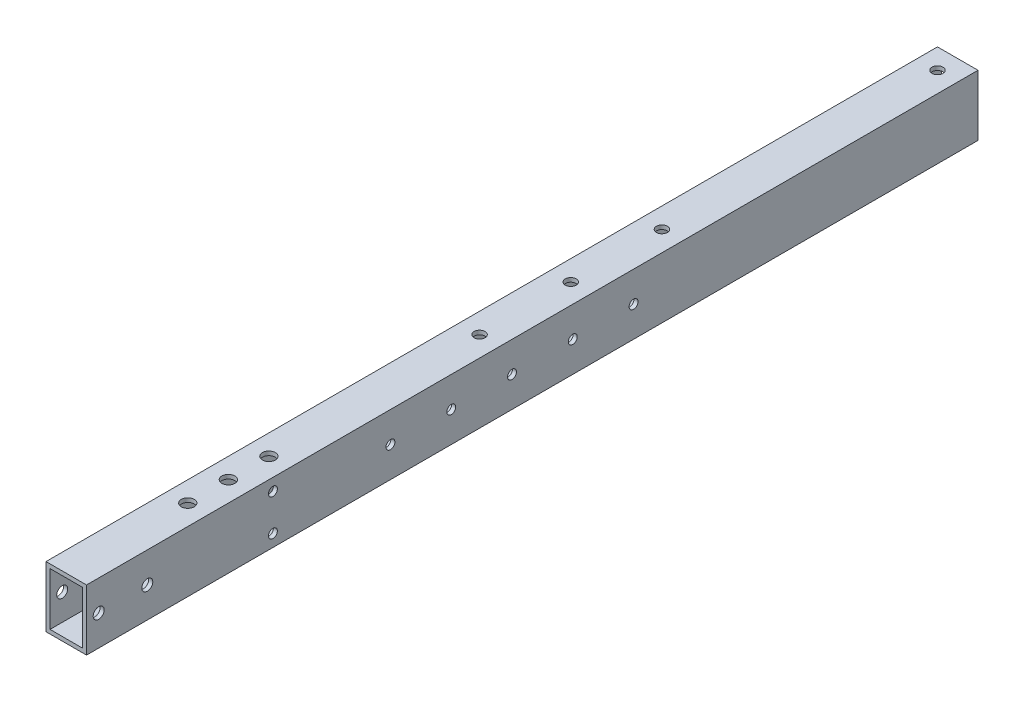
from build123d import *

# Parameters (mm, degrees)
SKETCH1_W             = 10
SKETCH1_H             = 15
SKETCH1_W_2           = 8
SKETCH1_H_2           = 13
F_20_X_20_X_2_1_DEPTH = 12.5
SKETCH14_W            = 25
SKETCH14_H            = 15
SKETCH14_W_2          = 23
SKETCH14_H_2          = 13
F_20_X_20_X_2_8_DEPTH = 71
SKETCH_8_W            = 10
SKETCH_8_H            = 15
SKETCH_8_W_2          = 8
SKETCH_8_H_2          = 13
EXTRUDE_1_DEPTH       = 220
SKETCH_9_R            = 1.05
SKETCH_9_R_2          = 1.35
SKETCH_9_R_3          = 1.6
SKETCH_9_W            = 4
SKETCH_9_H            = 7
CUT_EXTRUDE_3_DEPTH   = 217.967739537
SKETCH_10_W           = 12
SKETCH_10_H           = 15
CUT_EXTRUDE_4_DEPTH   = 1
SKETCH_11_R           = 1.1
SKETCH_11_R_2         = 1.35
CUT_EXTRUDE_5_DEPTH   = 218.959285189
SKETCH_14_W           = 25
SKETCH_14_H           = 71
CUT_EXTRUDE_6_DEPTH   = 217.967739537


with BuildPart() as part:
    # Sketch1 → 方形管 20 X 20 X 2(1) (new body)
    with BuildSketch(Plane.ZY):
        Rectangle(SKETCH1_W, SKETCH1_H)
        Rectangle(SKETCH1_W_2, SKETCH1_H_2, mode=Mode.SUBTRACT)
    extrude(amount=F_20_X_20_X_2_1_DEPTH)


with BuildPart() as body_2:
    # Sketch14 → 方形管 20 X 20 X 2(8) (new body)
    with BuildSketch(Plane(origin=(-12.5, 0, -5), x_dir=(1, 0, 0), z_dir=(0, 0, 1))):
        Rectangle(SKETCH14_W, SKETCH14_H)
        Rectangle(SKETCH14_W_2, SKETCH14_H_2, mode=Mode.SUBTRACT)
    extrude(amount=F_20_X_20_X_2_8_DEPTH)


with BuildPart() as body_3:
    # 草图8 → 凸台-拉伸1 (new body)
    with BuildSketch(Plane.XY.offset(-5)):
        with Locations((5, 0)):
            Rectangle(SKETCH_8_W, SKETCH_8_H)
        with Locations((5, 0)):
            Rectangle(SKETCH_8_W_2, SKETCH_8_H_2, mode=Mode.SUBTRACT)
    extrude(amount=EXTRUDE_1_DEPTH)


with BuildPart() as cut_extrude_3_tool:
    # 草图9 → 切除-拉伸3 (new, through all)
    with BuildSketch(Plane(origin=(0, 7.5, 0), x_dir=(1, 0, 0), z_dir=(0, 1, 0))):
        with Locations(Location((-4, -48.5, 0), (0, 0, 270))):
            Circle(SKETCH_9_R)
        with Locations(Location((-21, -48.5, 0), (0, 0, 180))):
            Circle(SKETCH_9_R)
        with Locations(Location((-21, -12.5, 0), (0, 0, 270))):
            Circle(SKETCH_9_R)
        with Locations(Location((-4, -12.5, 0), (0, 0, 180))):
            Circle(SKETCH_9_R)
        with Locations(Location((-4.5, -61, 0), (0, 0, 270))):
            Circle(SKETCH_9_R_2)
        with Locations(Location((-20.5, -61, 0), (0, 0, 180))):
            Circle(SKETCH_9_R_2)
        with Locations(Location((5, -68, 0), (0, 0, 270))):
            Circle(SKETCH_9_R_2)
        with Locations(Location((5, -90.5, 0), (0, 0, 270))):
            Circle(SKETCH_9_R_2)
        with Locations(Location((5, -113, 0), (0, 0, 270))):
            Circle(SKETCH_9_R_2)
        with Locations(Location((5, -175, 0), (0, 0, 270))):
            Circle(SKETCH_9_R_3)
        with Locations(Location((-22, 0, 0), (0, 0, 270))):
            Circle(SKETCH_9_R_2)
        with Locations(Location((5, 0, 0), (0, 0, 270))):
            Circle(SKETCH_9_R_2)
        with Locations(Location((-3, 0, 0), (0, 0, 180))):
            Circle(SKETCH_9_R_2)
        with Locations(Location((5, -185, 0), (0, 0, 270))):
            Circle(SKETCH_9_R_3)
        with Locations((5, -165)):
            Circle(SKETCH_9_R_3)
        with Locations((-16.5, -15.5)):
            Rectangle(SKETCH_9_W, SKETCH_9_H)
        with Locations((-16.5, -45.5)):
            Rectangle(SKETCH_9_W, SKETCH_9_H)
        with Locations((-8.5, -45.5)):
            Rectangle(SKETCH_9_W, SKETCH_9_H)
        with Locations((-8.5, -15.5)):
            Rectangle(SKETCH_9_W, SKETCH_9_H)
    extrude(amount=-CUT_EXTRUDE_3_DEPTH)


with BuildPart() as part_1:
    add(part.part)

    # 切除-拉伸3: cut by cut_extrude_3_tool
    add(cut_extrude_3_tool.part, mode=Mode.SUBTRACT)


with BuildPart() as body_2_1:
    add(body_2.part)

    # 切除-拉伸3: cut by cut_extrude_3_tool
    add(cut_extrude_3_tool.part, mode=Mode.SUBTRACT)

    # 草图10 → 切除-拉伸4 (cut)
    with BuildSketch(Plane(origin=(0, 7.5, 0), x_dir=(1, 0, 0), z_dir=(0, 1, 0))):
        with Locations((-12.5, -30.5)):
            Rectangle(SKETCH_10_W, SKETCH_10_H)
    extrude(amount=-CUT_EXTRUDE_4_DEPTH, mode=Mode.SUBTRACT)

    # 草图14 → 切除-拉伸6 (cut, through all)
    with BuildSketch(Plane(origin=(0, 7.5, 0), x_dir=(1, 0, 0), z_dir=(0, 1, 0))):
        with Locations((-12.5, -30.5)):
            Rectangle(SKETCH_14_W, SKETCH_14_H)
    extrude(amount=-CUT_EXTRUDE_6_DEPTH, mode=Mode.SUBTRACT)


with BuildPart() as body_3_1:
    add(body_3.part)

    # 切除-拉伸3: cut by cut_extrude_3_tool
    add(cut_extrude_3_tool.part, mode=Mode.SUBTRACT)

    # 草图11 → 切除-拉伸5 (cut, through all)
    with BuildSketch(Plane(origin=(10, 0, 0), x_dir=(0, 0, -1), z_dir=(1, 0, 0))):
        with Locations((-80, 0)):
            Circle(SKETCH_11_R)
        with Locations((-95, 0)):
            Circle(SKETCH_11_R)
        with Locations((-110, 0)):
            Circle(SKETCH_11_R)
        with Locations((-125, 0)):
            Circle(SKETCH_11_R)
        with Locations((-140, 0)):
            Circle(SKETCH_11_R)
        with Locations((-212, 0)):
            Circle(SKETCH_11_R_2)
        with Locations((-200, 0)):
            Circle(SKETCH_11_R_2)
        with Locations((-169, -4.5)):
            Circle(SKETCH_11_R)
        with Locations((-169, 4.5)):
            Circle(SKETCH_11_R)
    extrude(amount=-CUT_EXTRUDE_5_DEPTH, mode=Mode.SUBTRACT)


solid = body_3_1.part
